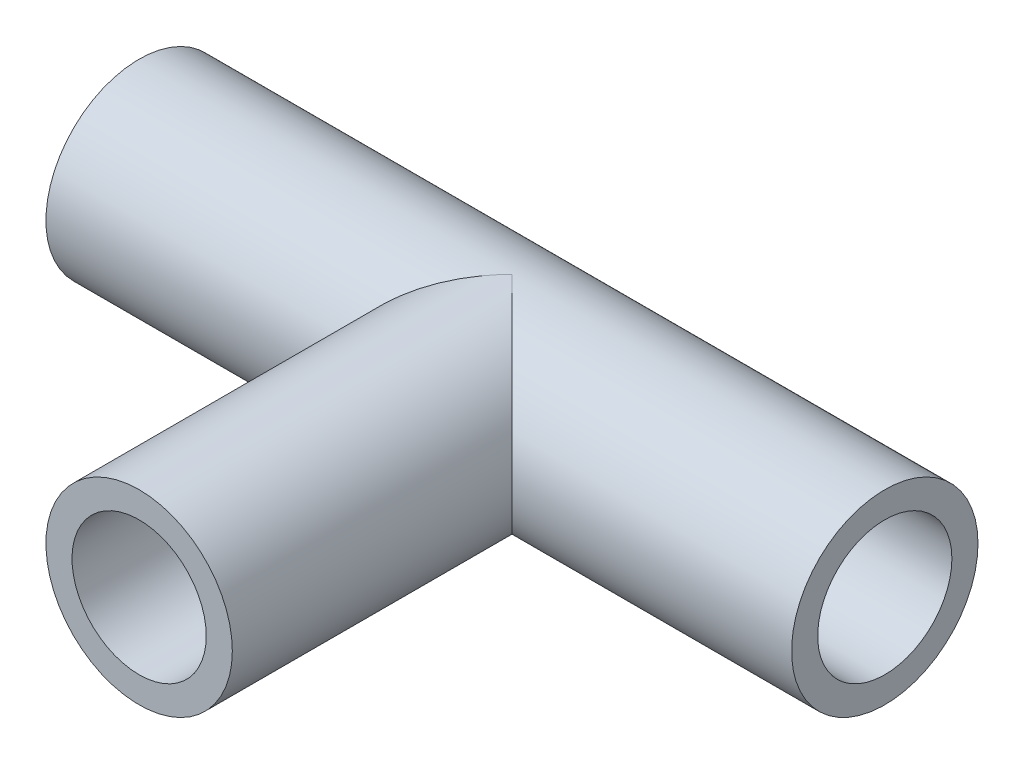
from build123d import *

# Parameters (mm, degrees)
SKETCH14_R          = 3.75
BOSS_EXTRUDE1_DEPTH = 30
SKETCH15_R          = 2.7
CUT_EXTRUDE4_DEPTH  = 30
SKETCH16_R          = 3.75
SKETCH16_R_2        = 2.7
BOSS_EXTRUDE2_DEPTH = 15
CUT_EXTRUDE5_START  = 25
SKETCH17_R          = 2.7
CUT_EXTRUDE5_DEPTH  = 25
SKETCH18_R          = 2.7
CUT_EXTRUDE6_DEPTH  = 25


with BuildPart() as part:
    # Sketch14 → Boss-Extrude1 (new body)
    with BuildSketch(Plane(origin=(0, 0, 0), x_dir=(0, 0, -1), z_dir=(1, 0, 0))):
        Circle(SKETCH14_R)
    extrude(amount=BOSS_EXTRUDE1_DEPTH)

    # Sketch15 → Cut-Extrude4 (cut)
    with BuildSketch(Plane(origin=(30, 0, 0), x_dir=(0, 0, -1), z_dir=(1, 0, 0))):
        Circle(SKETCH15_R)
    extrude(amount=-CUT_EXTRUDE4_DEPTH, mode=Mode.SUBTRACT)

    # Sketch16 → Boss-Extrude2 (add)
    with BuildSketch(Plane.XY):
        with Locations(Location((15, 0, 0), (0, 0, 90))):
            Circle(SKETCH16_R)
        with Locations((15, 0)):
            Circle(SKETCH16_R_2, mode=Mode.SUBTRACT)
    extrude(amount=BOSS_EXTRUDE2_DEPTH)

    # Sketch17 → Cut-Extrude5 (cut)
    with BuildSketch(Plane(origin=(0, 0, 0), x_dir=(0, 0, -1), z_dir=(1, 0, 0)).offset(CUT_EXTRUDE5_START)):
        Circle(SKETCH17_R)
    extrude(amount=-CUT_EXTRUDE5_DEPTH, mode=Mode.SUBTRACT)

    # Sketch18 → Cut-Extrude6 (cut)
    with BuildSketch(Plane.XY):
        with Locations(Location((15, 0, 0), (0, 0, 270))):
            Circle(SKETCH18_R)
    extrude(amount=CUT_EXTRUDE6_DEPTH, mode=Mode.SUBTRACT)


solid = part.part
